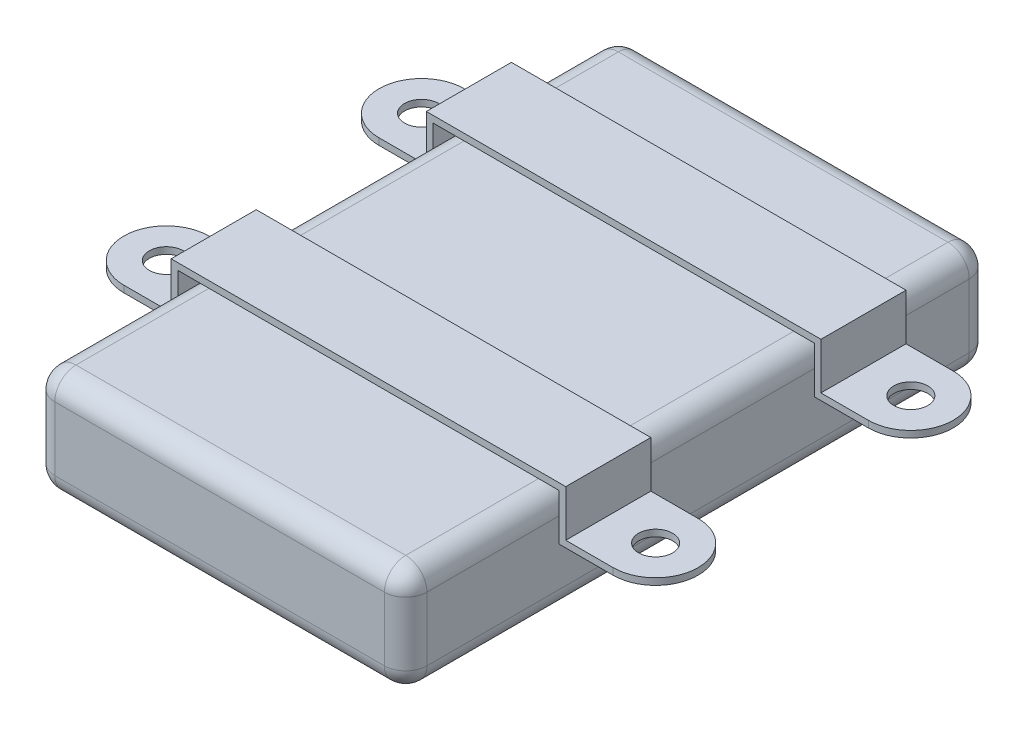
from build123d import *

# Parameters (mm, degrees)
SKETCH1_W      = 69.85
SKETCH1_H      = 12.7
EXTRUDE1_DEPTH = 22.225
FILLET1_R      = 2.54
EXTRUDE2_START = -27.94
EXTRUDE2_DEPTH = 10.16
EXTRUDE3_START = -58.42
EXTRUDE3_DEPTH = 10.16
SKETCH3_R      = 2.032
EXTRUDE4_DEPTH = 18.542


with BuildPart() as part:
    # Sketch1 → Extrude1 (new, symmetric)
    with BuildSketch(Plane(origin=(0, 0, 0), x_dir=(0, 0, -1), z_dir=(1, 0, 0))):
        with Locations((34.925, 6.35)):
            Rectangle(SKETCH1_W, SKETCH1_H)
    extrude(amount=EXTRUDE1_DEPTH, both=True)

    # Fillet1
    fillet1_edges = [part.edges().sort_by_distance(p)[0] for p in [
        (22.225, 12.7, -34.925),
        (22.225, 6.35, 0),
        (22.225, 0, -34.925),
        (-22.225, 6.35, 0),
        (-22.225, 12.7, -34.925),
        (-22.225, 6.35, -69.85),
        (-22.225, 0, -34.925),
        (22.225, 6.35, -69.85),
        (0, 0, 0),
        (0, 12.7, 0),
        (0, 12.7, -69.85),
        (0, 0, -69.85),
    ]]
    fillet(fillet1_edges, radius=FILLET1_R)


with BuildPart() as body_2:
    # Sketch2 → Extrude2 (new body)
    with BuildSketch(Plane.XY.offset(EXTRUDE2_START)):
        Polygon((-34.868909027, 7.784119326), (-22.771071042, 7.784119326), (-22.771071042, 13.333656019), (0, 13.333656019), (22.771071042, 13.333656019), (22.771071042, 7.784119326), (34.868909027, 7.784119326), (34.868909027, 8.577869326), (23.564821042, 8.577869326), (23.564821042, 14.127406019), (0, 14.127406019), (-23.564821042, 14.127406019), (-23.564821042, 8.577869326), (-34.868909027, 8.577869326), align=None)
    extrude(amount=EXTRUDE2_DEPTH)


with BuildPart() as body_3:
    # Sketch2<2> → Extrude3 (new body)
    with BuildSketch(Plane.XY.offset(EXTRUDE3_START)):
        Polygon((-34.868909027, 7.784119326), (-22.771071042, 7.784119326), (-22.771071042, 13.333656019), (0, 13.333656019), (22.771071042, 13.333656019), (22.771071042, 7.784119326), (34.868909027, 7.784119326), (34.868909027, 8.577869326), (23.564821042, 8.577869326), (23.564821042, 14.127406019), (0, 14.127406019), (-23.564821042, 14.127406019), (-23.564821042, 8.577869326), (-34.868909027, 8.577869326), align=None)
    extrude(amount=EXTRUDE3_DEPTH)


with BuildPart() as extrude4_tool:
    # Sketch3 → Extrude4 (new body)
    with BuildSketch(Plane(origin=(0, 0, 0), x_dir=(1, 0, 0), z_dir=(0, 1, 0))):
        with Locations((29.216865034, 53.34)):
            Circle(SKETCH3_R)
        with Locations((29.216865034, 22.86)):
            Circle(SKETCH3_R)
        with Locations(Location((-29.216865034, 22.86, 0), (0, 0, 90))):
            Circle(SKETCH3_R)
        with Locations(Location((-29.216865034, 53.34, 0), (0, 0, 90))):
            Circle(SKETCH3_R)
        with BuildLine():
            Line((-29.216865034, 58.42), (-40.15144848, 58.42))
            Line((-40.15144848, 58.42), (-40.15144848, 48.26))
            Line((-40.15144848, 48.26), (-29.216865034, 48.26))
            ThreePointArc((-29.216865034, 48.26), (-34.296865034, 53.34), (-29.216865034, 58.42))
        make_face()
        with BuildLine():
            Line((-29.216865034, 17.78), (-40.15144848, 17.78))
            Line((-40.15144848, 17.78), (-40.15144848, 27.94))
            Line((-40.15144848, 27.94), (-29.216865034, 27.94))
            ThreePointArc((-29.216865034, 27.94), (-34.296865034, 22.86), (-29.216865034, 17.78))
        make_face()
        with BuildLine():
            Line((40.15144848, 48.26), (29.216865034, 48.26))
            ThreePointArc((29.216865034, 48.26), (34.296865034, 53.34), (29.216865034, 58.42))
            Line((29.216865034, 58.42), (40.15144848, 58.42))
            Line((40.15144848, 58.42), (40.15144848, 48.26))
        make_face()
        with BuildLine():
            Line((40.15144848, 17.78), (40.15144848, 27.94))
            Line((40.15144848, 27.94), (29.216865034, 27.94))
            ThreePointArc((29.216865034, 27.94), (34.296865034, 22.86), (29.216865034, 17.78))
            Line((29.216865034, 17.78), (40.15144848, 17.78))
        make_face()
    extrude(amount=EXTRUDE4_DEPTH)


with BuildPart() as body_2_1:
    add(body_2.part)

    # Extrude4: cut by extrude4_tool
    add(extrude4_tool.part, mode=Mode.SUBTRACT)


with BuildPart() as body_3_1:
    add(body_3.part)

    # Extrude4: cut by extrude4_tool
    add(extrude4_tool.part, mode=Mode.SUBTRACT)


solid = Compound([part.part, body_2_1.part, body_3_1.part])
